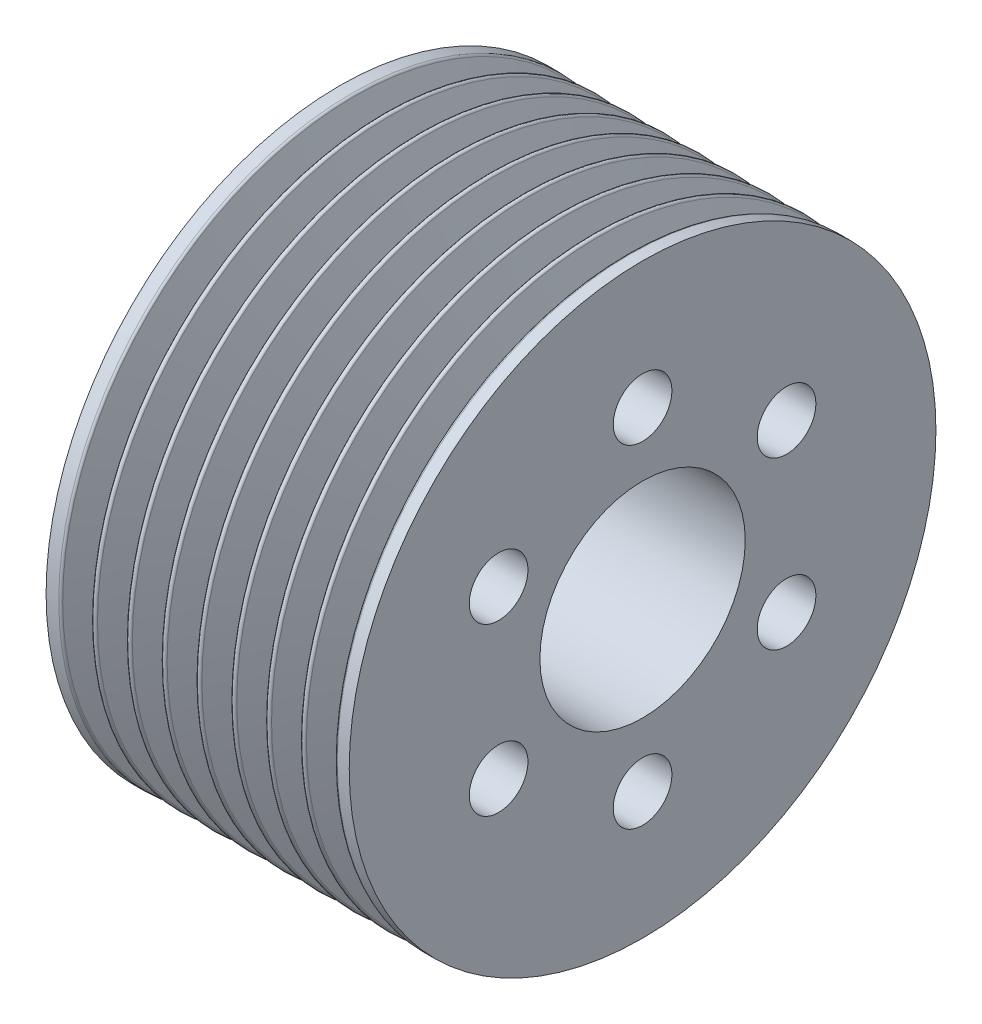
from build123d import *

# Parameters (mm, degrees)
LPATTERN1_COUNT    = 8
LPATTERN1_PITCH    = 3.56
SKETCH3_R          = 3
CUT_EXTRUDE1_DEPTH = 17.5


with BuildPart() as part:
    # Sketch1 → Revolve1 (revolve)
    with BuildSketch(Plane.XY, mode=Mode.PRIVATE) as revolve1_sk:
        Polygon((49, 10.5), (49, 30), (18, 30), (18, 21.5), (31.5, 21.5), (31.5, 10.5), align=None)
    revolve(revolve1_sk.sketch.rotate(Axis((0, 0, 0), (1, 0, 0)), 90), axis=Axis((0, 0, 0), (1, 0, 0)))

    # Sketch2 → Cut-Revolve1 (revolve, cut)
    with BuildSketch(Plane.XY, mode=Mode.PRIVATE) as cut_revolve1_sk:
        with BuildLine():
            Line((47.545076845, 29.835505036), (46.281907786, 26.36497657))
            ThreePointArc((46.281907786, 26.36497657), (46, 26.167582613), (45.718092214, 26.36497657))
            Line((45.718092214, 26.36497657), (44.454923155, 29.835505036))
            ThreePointArc((44.454923155, 29.835505036), (44.363394109, 29.954788011), (44.22, 30))
            Line((44.22, 30), (47.78, 30))
            ThreePointArc((47.78, 30), (47.636605891, 29.954788011), (47.545076845, 29.835505036))
        make_face()
    cut_revolve1 = revolve(cut_revolve1_sk.sketch.rotate(Axis((0, 0, 0), (1, 0, 0)), 90), axis=Axis((0, 0, 0), (1, 0, 0)), mode=Mode.SUBTRACT)

    # LPattern1: Cut-Revolve1 ×8
    with Locations(*[(-i * LPATTERN1_PITCH, 0, 0) for i in range(1, LPATTERN1_COUNT)]):
        add(cut_revolve1, mode=Mode.SUBTRACT)

    # Sketch3 → Cut-Extrude1 (cut)
    with BuildSketch(Plane(origin=(49, 0, 0), x_dir=(0, 0, -1), z_dir=(1, 0, 0))):
        with Locations((0, 17)):
            Circle(SKETCH3_R)
        with Locations((14.722431864, 8.5)):
            Circle(SKETCH3_R)
        with Locations((14.722431864, -8.5)):
            Circle(SKETCH3_R)
        with Locations((0, -17)):
            Circle(SKETCH3_R)
        with Locations((-14.722431864, -8.5)):
            Circle(SKETCH3_R)
        with Locations((-14.722431864, 8.5)):
            Circle(SKETCH3_R)
    extrude(amount=-CUT_EXTRUDE1_DEPTH, mode=Mode.SUBTRACT)


solid = part.part
